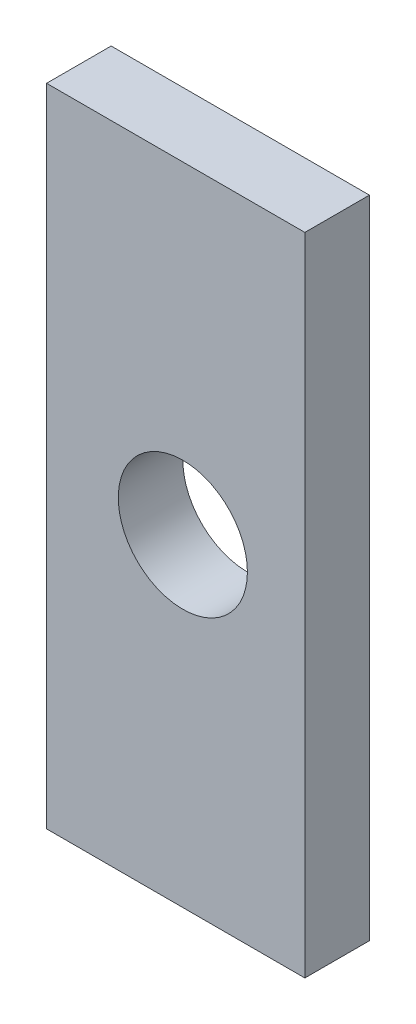
from build123d import *

# Parameters (mm, degrees)
SKETCH1_W           = 12.7
SKETCH1_H           = 31.75
SKETCH1_R           = 3.175
BOSS_EXTRUDE1_DEPTH = 3.175


with BuildPart() as part:
    # Sketch1 → Boss-Extrude1 (new body)
    with BuildSketch(Plane.XY):
        with Locations((-217.875120391, -183.362379694)):
            Rectangle(SKETCH1_W, SKETCH1_H)
        with Locations((-217.525120391, -183.362379694)):
            Circle(SKETCH1_R, mode=Mode.SUBTRACT)
    extrude(amount=-BOSS_EXTRUDE1_DEPTH)


solid = part.part
